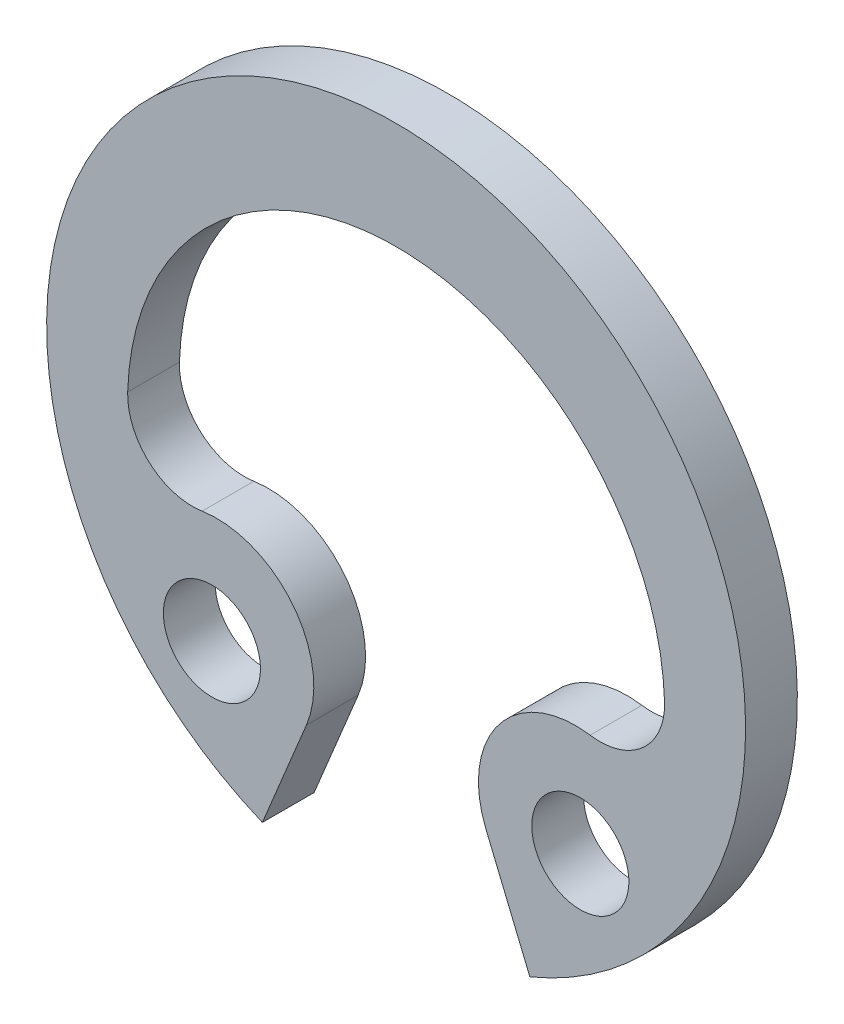
from build123d import *

# Parameters (mm, degrees)
SKETCH_1_R        = 0.75
EXTRUDE_879_DEPTH = 0.8


with BuildPart() as part:
    # 草图1 → Extrude 879 (new body)
    with BuildSketch(Plane.XY):
        with BuildLine():
            Line((-1.385948162, -3.345974849), (-2.066490535, -4.988949476))
            ThreePointArc((-2.066490535, -4.988949476), (0, 5.4), (2.066490535, -4.988949476))
            Line((2.066490535, -4.988949476), (1.385948162, -3.345974849))
            ThreePointArc((1.385948162, -3.345974849), (1.591085636, -1.846752193), (2.997763625, -1.289072183))
            ThreePointArc((2.997763625, -1.289072183), (3.811994555, -1.04860419), (4.147928602, -0.268895796))
            ThreePointArc((4.147928602, -0.268895796), (0, 3.75), (-4.147928602, -0.268895796))
            ThreePointArc((-4.147928602, -0.268895796), (-3.811994555, -1.04860419), (-2.997763625, -1.289072183))
            ThreePointArc((-2.997763625, -1.289072183), (-1.591085636, -1.846752193), (-1.385948162, -3.345974849))
        make_face()
        with Locations((-2.84604621, -2.951274465)):
            Circle(SKETCH_1_R, mode=Mode.SUBTRACT)
        with Locations(Location((2.84604621, -2.951274465, 0), (0, 0, 180))):
            Circle(SKETCH_1_R, mode=Mode.SUBTRACT)
    extrude(amount=EXTRUDE_879_DEPTH)


solid = part.part
